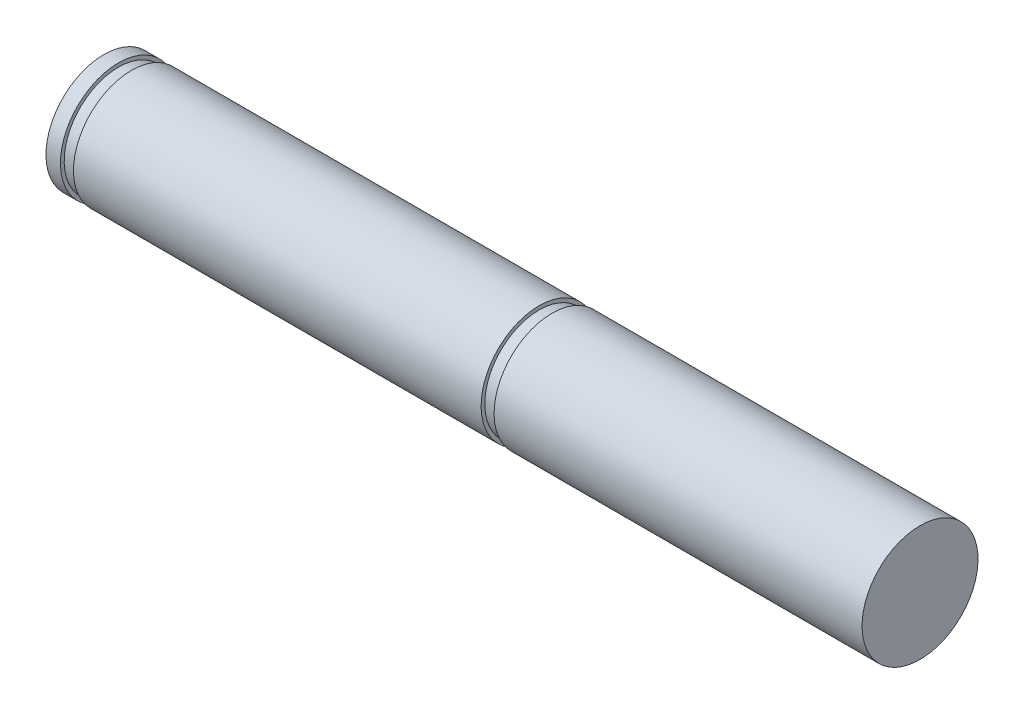
from build123d import *


with BuildPart() as part:
    # Sketch1 → Revolve1 (revolve)
    with BuildSketch(Plane.XY):
        Polygon((0, 0), (0, 6.35), (1.5875, 6.35), (1.5875, 5.9436), (3.0099, 5.9436), (3.0099, 6.35), (47.6504, 6.35), (47.6504, 5.9436), (49.0728, 5.9436), (49.0728, 6.35), (89.3699, 6.35), (89.3699, 0), align=None)
    revolve(axis=Axis((0, 0, 0), (-1, 0, 0)))


solid = part.part
